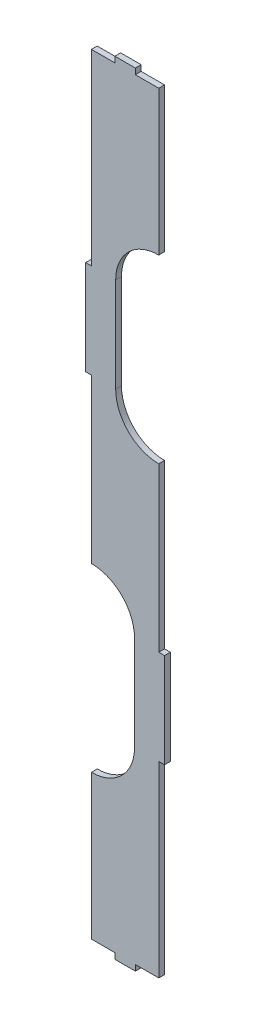
from build123d import *

# Parameters (mm, degrees)
BOSS_EXTRUDE1_DEPTH = 4.3


with BuildPart() as part:
    # Sketch2 → Boss-Extrude1 (new body)
    with BuildSketch(Plane.XY):
        with BuildLine():
            Line((-25, -286), (-7.6, -286))
            Line((-7.6, -286), (-7.6, -290.3))
            Line((-7.6, -290.3), (7.6, -290.3))
            Line((7.6, -290.3), (7.6, -286))
            Line((7.6, -286), (25, -286))
            Line((25, -286), (25, -146.7666))
            Line((25, -146.7666), (29.3, -146.7666))
            Line((29.3, -146.7666), (29.3, -76.5666))
            Line((29.3, -76.5666), (25, -76.5666))
            Line((25, -76.5666), (25, 44.5667))
            ThreePointArc((25, 44.5667), (2.372583002, 53.939283002), (-7, 76.5667))
            Line((-7, 76.5667), (-7, 146.7667))
            ThreePointArc((-7, 146.7667), (2.372583002, 169.394116998), (25, 178.7667))
            Line((25, 178.7667), (25, 286))
            Line((25, 286), (7.6, 286))
            Line((7.6, 286), (7.6, 290.3))
            Line((7.6, 290.3), (-7.6, 290.3))
            Line((-7.6, 290.3), (-7.6, 286))
            Line((-7.6, 286), (-25, 286))
            Line((-25, 286), (-25, 146.7667))
            Line((-25, 146.7667), (-29.3, 146.7667))
            Line((-29.3, 146.7667), (-29.3, 76.5667))
            Line((-29.3, 76.5667), (-25, 76.5667))
            Line((-25, 76.5667), (-25, -44.5666))
            ThreePointArc((-25, -44.5666), (-2.372583002, -53.939183002), (7, -76.5666))
            Line((7, -76.5666), (7, -146.7666))
            ThreePointArc((7, -146.7666), (-2.372583002, -169.394016998), (-25, -178.7666))
            Line((-25, -178.7666), (-25, -286))
        make_face()
    extrude(amount=BOSS_EXTRUDE1_DEPTH)


solid = part.part
